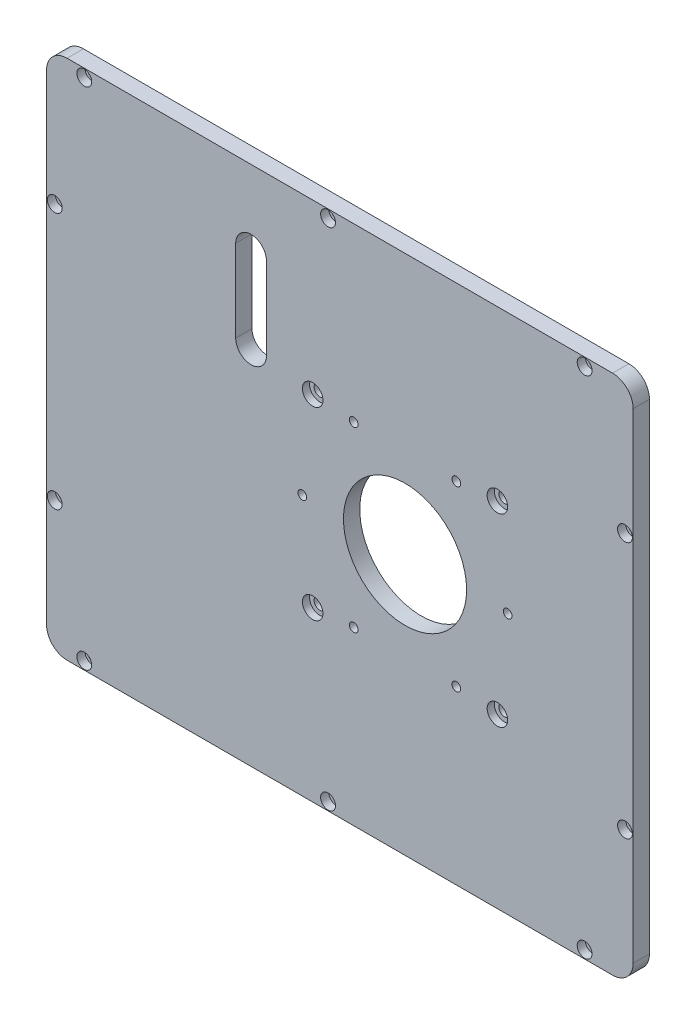
from build123d import *

# Parameters (mm, degrees)
TAPA_1_4IN_START                               = 63.5
TAPA_1_4IN_DEPTH                               = 6.35
PASO_M1_ROSCA_ARO_SEPARADORES_Y_TORNILLO_START = 63.5
CROQUIS2_R                                     = 24
CROQUIS2_R_2                                   = 2.25
CROQUIS2_R_3                                   = 1.25
CROQUIS2_R_4                                   = 1.7
PASO_M1_ROSCA_ARO_SEPARADORES_Y_TORNILLO_DEPTH = 6.35
REFRENTADO_M4_CABEZA_BAJA_START                = 67.05
CROQUIS3_R                                     = 4
REFRENTADO_M4_CABEZA_BAJA_DEPTH                = 2.8
REFRENTADO_M3_START                            = 66.65
CROQUIS4_R                                     = 2.9
REFRENTADO_M3_DEPTH                            = 3.2
RANURA_CABLES_POTENCIA_CAN_START               = 63.5
RANURA_CABLES_POTENCIA_CAN_DEPTH               = 6.35
PASO_M3_ARO_TUERCA_START                       = 63.5
CROQUIS6_R                                     = 1.7
PASO_M3_ARO_TUERCA_DEPTH                       = 6.35


with BuildPart() as part:
    # Croquis1 → Tapa_1-4in (new body)
    with BuildSketch(Plane.XY.offset(TAPA_1_4IN_START)):
        with BuildLine():
            Line((-131.7, -101.6), (80.9, -101.6))
            ThreePointArc((80.9, -101.6), (86.556854249, -99.256854249), (88.9, -93.6))
            Line((88.9, -93.6), (88.9, 93.6))
            ThreePointArc((88.9, 93.6), (86.556854249, 99.256854249), (80.9, 101.6))
            Line((80.9, 101.6), (-131.7, 101.6))
            ThreePointArc((-131.7, 101.6), (-137.356854249, 99.256854249), (-139.7, 93.6))
            Line((-139.7, 93.6), (-139.7, -93.6))
            ThreePointArc((-139.7, -93.6), (-137.356854249, -99.256854249), (-131.7, -101.6))
        make_face()
    extrude(amount=TAPA_1_4IN_DEPTH)

    # Croquis2 → Paso_M1_rosca_aro_separadores_y_tornillos (cut)
    with BuildSketch(Plane.XY.offset(PASO_M1_ROSCA_ARO_SEPARADORES_Y_TORNILLO_START)):
        Circle(CROQUIS2_R)
        with Locations((-36, -36)):
            Circle(CROQUIS2_R_2)
        with Locations((-36, 36)):
            Circle(CROQUIS2_R_2)
        with Locations((36, -36)):
            Circle(CROQUIS2_R_2)
        with Locations((36, 36)):
            Circle(CROQUIS2_R_2)
        with Locations((40, 0)):
            Circle(CROQUIS2_R_3)
        with Locations((20, 34.641016151)):
            Circle(CROQUIS2_R_3)
        with Locations((-20, 34.641016151)):
            Circle(CROQUIS2_R_3)
        with Locations((-40, 0)):
            Circle(CROQUIS2_R_3)
        with Locations((-20, -34.641016151)):
            Circle(CROQUIS2_R_3)
        with Locations((20, -34.641016151)):
            Circle(CROQUIS2_R_3)
        with Locations((-125, 98.425)):
            Circle(CROQUIS2_R_4)
        with Locations((-125, -98.425)):
            Circle(CROQUIS2_R_4)
        with Locations((-30, 98.425)):
            Circle(CROQUIS2_R_4)
        with Locations((-30, -98.425)):
            Circle(CROQUIS2_R_4)
        with Locations((70, 98.425)):
            Circle(CROQUIS2_R_4)
        with Locations((70, -98.425)):
            Circle(CROQUIS2_R_4)
        with Locations((-136.525, -50)):
            Circle(CROQUIS2_R_4)
        with Locations((-136.525, 50)):
            Circle(CROQUIS2_R_4)
        with Locations((85.725, -50)):
            Circle(CROQUIS2_R_4)
        with Locations((85.725, 50)):
            Circle(CROQUIS2_R_4)
    extrude(amount=PASO_M1_ROSCA_ARO_SEPARADORES_Y_TORNILLO_DEPTH, mode=Mode.SUBTRACT)

    # Croquis3 → Refrentado_M4_cabeza_baja (cut)
    with BuildSketch(Plane.XY.offset(REFRENTADO_M4_CABEZA_BAJA_START)):
        with Locations(Location((-36, -36, 0), (0, 0, 180))):
            Circle(CROQUIS3_R)
        with Locations(Location((-36, 36, 0), (0, 0, 180))):
            Circle(CROQUIS3_R)
        with Locations(Location((36, -36, 0), (0, 0, 180))):
            Circle(CROQUIS3_R)
        with Locations(Location((36, 36, 0), (0, 0, 180))):
            Circle(CROQUIS3_R)
    extrude(amount=REFRENTADO_M4_CABEZA_BAJA_DEPTH, mode=Mode.SUBTRACT)

    # Croquis4 → Refrentado_M3 (cut)
    with BuildSketch(Plane.XY.offset(REFRENTADO_M3_START)):
        with Locations((-125, 98.425)):
            Circle(CROQUIS4_R)
        with Locations((-125, -98.425)):
            Circle(CROQUIS4_R)
        with Locations((-30, 98.425)):
            Circle(CROQUIS4_R)
        with Locations((-30, -98.425)):
            Circle(CROQUIS4_R)
        with Locations((70, 98.425)):
            Circle(CROQUIS4_R)
        with Locations((70, -98.425)):
            Circle(CROQUIS4_R)
        with Locations((-136.525, -50)):
            Circle(CROQUIS4_R)
        with Locations((-136.525, 50)):
            Circle(CROQUIS4_R)
        with Locations((85.725, -50)):
            Circle(CROQUIS4_R)
        with Locations((85.725, 50)):
            Circle(CROQUIS4_R)
    extrude(amount=REFRENTADO_M3_DEPTH, mode=Mode.SUBTRACT)

    # Croquis5 → Ranura_cables_potencia_CAN (cut)
    with BuildSketch(Plane.XY.offset(RANURA_CABLES_POTENCIA_CAN_START)):
        with BuildLine():
            Line((-66, 40), (-66, 72))
            ThreePointArc((-66, 72), (-60, 78), (-54, 72))
            Line((-54, 72), (-54, 40))
            ThreePointArc((-54, 40), (-60, 34), (-66, 40))
        make_face()
    extrude(amount=RANURA_CABLES_POTENCIA_CAN_DEPTH, mode=Mode.SUBTRACT)

    # Croquis6 → Paso_M3_aro_tuerca (cut)
    with BuildSketch(Plane.XY.offset(PASO_M3_ARO_TUERCA_START)):
        with Locations((40, 0)):
            Circle(CROQUIS6_R)
        with Locations((20, 34.641016151)):
            Circle(CROQUIS6_R)
        with Locations((-20, 34.641016151)):
            Circle(CROQUIS6_R)
        with Locations((-40, 0)):
            Circle(CROQUIS6_R)
        with Locations((-20, -34.641016151)):
            Circle(CROQUIS6_R)
        with Locations((20, -34.641016151)):
            Circle(CROQUIS6_R)
    extrude(amount=PASO_M3_ARO_TUERCA_DEPTH, mode=Mode.SUBTRACT)


solid = part.part
